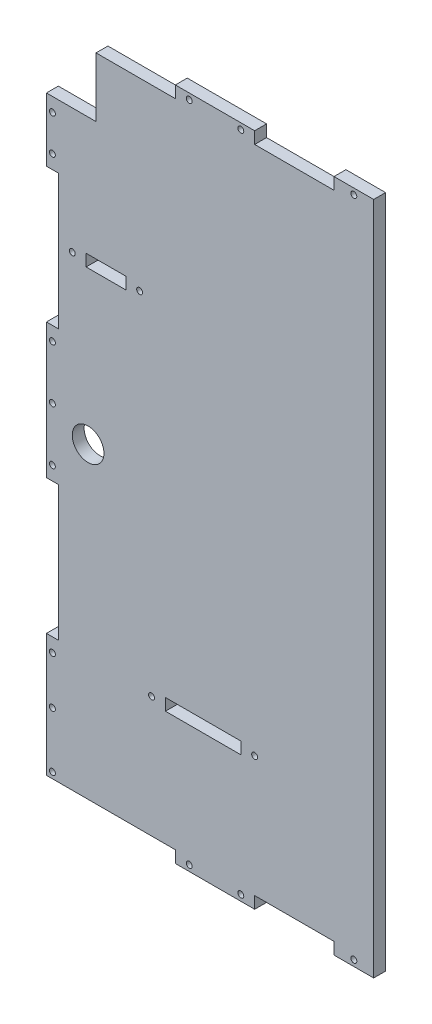
from build123d import *

# Parameters (mm, degrees)
ESQUISSE2_W                            = 330
ESQUISSE2_H                            = 340
BOSS_EXTRU_1_DEPTH                     = 6
ESQUISSE4_W                            = 65
ESQUISSE4_H                            = 6
ESQUISSE4_W_2                          = 40
ESQUISSE4_W_3                          = 6
ESQUISSE4_H_2                          = 68
ENL_V_MAT_ENCOCHE_BORD_DEPTH           = 474.852297662
ESQUISSE5_W                            = 38
ESQUISSE5_H                            = 6
ESQUISSE5_W_2                          = 25
ESQUISSE5_H_2                          = 30
ESQUISSE5_W_3                          = 15
ESQUISSE5_H_3                          = 10
ESQUISSE5_W_4                          = 20
ENL_V_MAT_ENCOCHE_TAGE_ROULETTES_DEPTH = 474.852297662
ESQUISSE6_R                            = 8
ENL_V_MAT_EXTRU_1_DEPTH                = 10
ESQUISSE7_W                            = 165
ESQUISSE7_H                            = 340.861655668
ENL_V_MAT_EXTRU_2_DEPTH                = 474.852297662
ESQUISSE8_R                            = 1.5
ENL_V_MAT_EXTRU_3_DEPTH                = 474.852297662
ESQUISSE9_R                            = 2.995
ESQUISSE9_R_2                          = 3
ENL_V_MAT_EXTRU_4_DEPTH                = 3


with BuildPart() as part:
    # Esquisse2 → Boss.-Extru.1 (new body)
    with BuildSketch(Plane.XY):
        with Locations((-165, -170)):
            Rectangle(ESQUISSE2_W, ESQUISSE2_H)
    extrude(amount=BOSS_EXTRU_1_DEPTH)

    # Esquisse4 → Enlèv. mat encoche bord (cut, through all)
    with BuildSketch(Plane(origin=(0, 0, 0), x_dir=(-1, 0, 0), z_dir=(0, 0, -1))):
        with Locations((297.5, -3)):
            Rectangle(ESQUISSE4_W, ESQUISSE4_H)
        with Locations((205, -3)):
            Rectangle(ESQUISSE4_W_2, ESQUISSE4_H)
        with Locations((125, -3)):
            Rectangle(ESQUISSE4_W_2, ESQUISSE4_H)
        with Locations((32.5, -3)):
            Rectangle(ESQUISSE4_W, ESQUISSE4_H)
        with Locations((327, -102)):
            Rectangle(ESQUISSE4_W_3, ESQUISSE4_H_2)
        with Locations((3, -102)):
            Rectangle(ESQUISSE4_W_3, ESQUISSE4_H_2)
        with Locations((297.5, -337)):
            Rectangle(ESQUISSE4_W, ESQUISSE4_H)
        with Locations((205, -337)):
            Rectangle(ESQUISSE4_W_2, ESQUISSE4_H)
        with Locations((125, -337)):
            Rectangle(ESQUISSE4_W_2, ESQUISSE4_H)
        with Locations((32.5, -337)):
            Rectangle(ESQUISSE4_W, ESQUISSE4_H)
        with Locations((327, -238)):
            Rectangle(ESQUISSE4_W_3, ESQUISSE4_H_2)
        with Locations((3, -238)):
            Rectangle(ESQUISSE4_W_3, ESQUISSE4_H_2)
    extrude(amount=-ENL_V_MAT_ENCOCHE_BORD_DEPTH, mode=Mode.SUBTRACT)

    # Esquisse5 → Enlèv. mat encoche étage + roulettes (cut, through all)
    with BuildSketch(Plane(origin=(0, 0, 0), x_dir=(-1, 0, 0), z_dir=(0, 0, -1))):
        with Locations((251, -273)):
            Rectangle(ESQUISSE5_W, ESQUISSE5_H)
        with Locations((79, -273)):
            Rectangle(ESQUISSE5_W, ESQUISSE5_H)
        with Locations((317.5, -21)):
            Rectangle(ESQUISSE5_W_2, ESQUISSE5_H_2)
        with Locations((7.5, -11)):
            Rectangle(ESQUISSE5_W_3, ESQUISSE5_H_3)
        with Locations((300, -99)):
            Rectangle(ESQUISSE5_W_4, ESQUISSE5_H)
        with Locations((30, -99)):
            Rectangle(ESQUISSE5_W_4, ESQUISSE5_H)
    extrude(amount=-ENL_V_MAT_ENCOCHE_TAGE_ROULETTES_DEPTH, mode=Mode.SUBTRACT)

    # Esquisse6 → Enlèv. mat.-Extru.1 (cut)
    with BuildSketch(Plane.XY.offset(6)):
        with Locations((-21, -178.92)):
            Circle(ESQUISSE6_R)
        with Locations((-309, -178.92)):
            Circle(ESQUISSE6_R)
    extrude(amount=-ENL_V_MAT_EXTRU_1_DEPTH, mode=Mode.SUBTRACT)

    # Esquisse7 → Enlèv. mat.-Extru.2 (cut, through all)
    with BuildSketch(Plane.XY.offset(6)):
        with Locations((-82.5, -170.430827834)):
            Rectangle(ESQUISSE7_W, ESQUISSE7_H)
    extrude(amount=-ENL_V_MAT_EXTRU_2_DEPTH, mode=Mode.SUBTRACT)

    # Esquisse8 → Enlèv. mat.-Extru.3 (cut, through all)
    with BuildSketch(Plane(origin=(0, 0, 0), x_dir=(-1, 0, 0), z_dir=(0, 0, -1))):
        with Locations((175, -337)):
            Circle(ESQUISSE8_R)
        with Locations((232, -337)):
            Circle(ESQUISSE8_R)
        with Locations((258, -337)):
            Circle(ESQUISSE8_R)
        with Locations((327, -331)):
            Circle(ESQUISSE8_R)
        with Locations((327, -303)):
            Circle(ESQUISSE8_R)
        with Locations((327, -279)):
            Circle(ESQUISSE8_R)
        with Locations((277, -273)):
            Circle(ESQUISSE8_R)
        with Locations((225, -273)):
            Circle(ESQUISSE8_R)
        with Locations((327, -197)):
            Circle(ESQUISSE8_R)
        with Locations((327, -170)):
            Circle(ESQUISSE8_R)
        with Locations((327, -143)):
            Circle(ESQUISSE8_R)
        with Locations((327, -61)):
            Circle(ESQUISSE8_R)
        with Locations((327, -43)):
            Circle(ESQUISSE8_R)
        with Locations((258, -3)):
            Circle(ESQUISSE8_R)
        with Locations((232, -3)):
            Circle(ESQUISSE8_R)
        with Locations((175, -3)):
            Circle(ESQUISSE8_R)
        with Locations((317, -99)):
            Circle(ESQUISSE8_R)
        with Locations((283, -99)):
            Circle(ESQUISSE8_R)
    extrude(amount=-ENL_V_MAT_EXTRU_3_DEPTH, mode=Mode.SUBTRACT)

    # Esquisse9 → Enlèv. mat.-Extru.4 (cut)
    with BuildSketch(Plane(origin=(0, 0, 0), x_dir=(-1, 0, 0), z_dir=(0, 0, -1))):
        with Locations((327, -43)):
            Circle(ESQUISSE9_R)
        with Locations((327, -61)):
            Circle(ESQUISSE9_R)
        with Locations((317, -99)):
            Circle(ESQUISSE9_R)
        with Locations((283, -99)):
            Circle(ESQUISSE9_R)
        with Locations((327, -143)):
            Circle(ESQUISSE9_R)
        with Locations((327, -170)):
            Circle(ESQUISSE9_R)
        with Locations((327, -331)):
            Circle(ESQUISSE9_R)
        with Locations((327, -303)):
            Circle(ESQUISSE9_R)
        with Locations((327, -279)):
            Circle(ESQUISSE9_R)
        with Locations((277, -273)):
            Circle(ESQUISSE9_R_2)
        with Locations((225, -273)):
            Circle(ESQUISSE9_R_2)
        with Locations((258, -337)):
            Circle(ESQUISSE9_R)
        with Locations((232, -337)):
            Circle(ESQUISSE9_R)
        with Locations((175, -337)):
            Circle(ESQUISSE9_R)
        with Locations((327, -197)):
            Circle(ESQUISSE9_R)
        with Locations((258, -3)):
            Circle(ESQUISSE9_R)
        with Locations((232, -3)):
            Circle(ESQUISSE9_R)
        with Locations((175, -3)):
            Circle(ESQUISSE9_R)
    extrude(amount=-ENL_V_MAT_EXTRU_4_DEPTH, mode=Mode.SUBTRACT)


solid = part.part
